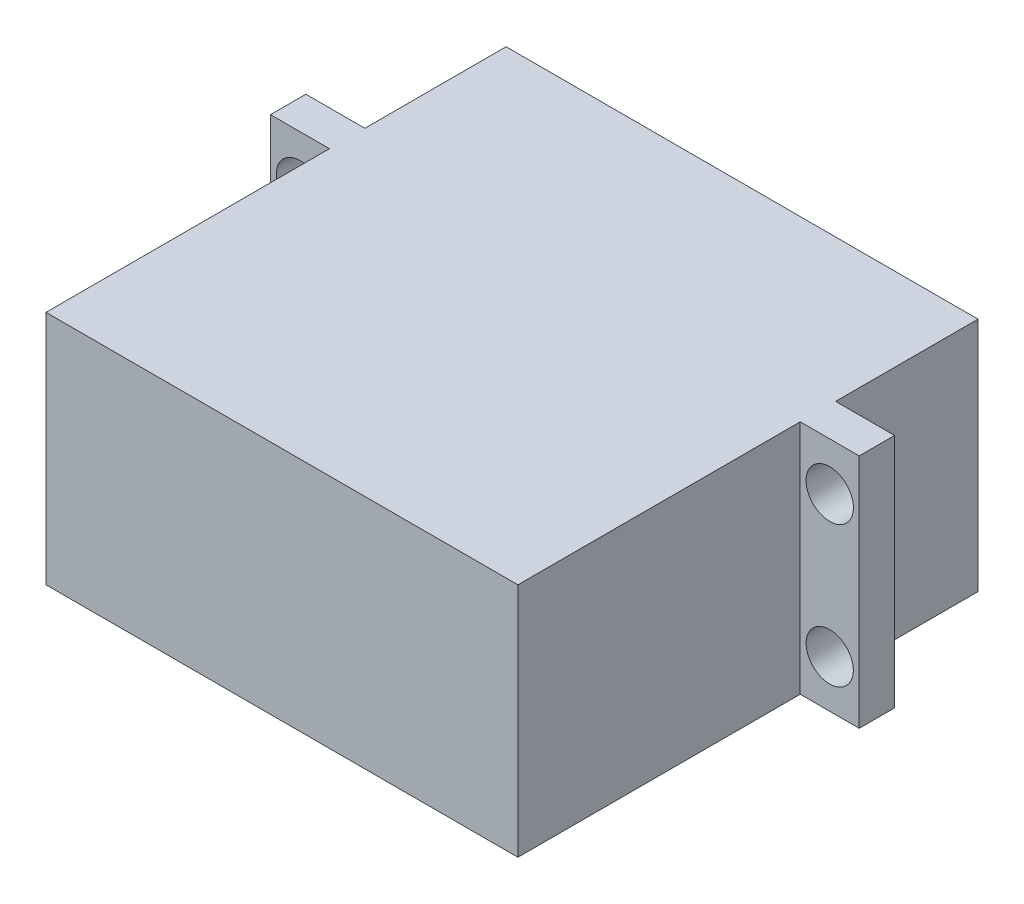
from build123d import *

# Parameters (mm, degrees)
SKETCH_3_W               = 40
SKETCH_3_H               = 20
EXTRUDE_2_DEPTH          = 39
SKETCH_4_W               = 3
SKETCH_4_H               = 20
EXTRUDE_3_DEPTH          = 5
SKETCH_7_W               = 3
SKETCH_7_H               = 20
EXTRUDE_4_DEPTH          = 5
SKETCH_9_R               = 2
CUT_EXTRUDE_1_DEPTH      = 3
SKETCH_10_R              = 2.009071102
SKETCH_10_R_2            = 2
CUT_EXTRUDE_2_DEPTH      = 3
SKETCH_11_R              = 3
EXTRUDE_6_DEPTH          = 6
SKETCH_16_R              = 6
EXTRUDE_8_DEPTH          = 1.5
SKETCH_17_R              = 7
EXTRUDE_9_DEPTH          = 1
HOLE_WIZARD_3_48_1_D     = 1.9939
HOLE_WIZARD_3_48_1_DEPTH = 3
HOLE_WIZARD_3_48_1_TIP   = 0.599027994


with BuildPart() as part:
    # 草图3 → 凸台-拉伸2 (new body)
    with BuildSketch(Plane.XY):
        with Locations((-53.793598947, 3.253632602)):
            Rectangle(SKETCH_3_W, SKETCH_3_H)
    extrude(amount=EXTRUDE_2_DEPTH)

    # 草图4 → 凸台-拉伸3 (add)
    with BuildSketch(Plane(origin=(-33.793598947, 0, 0), x_dir=(0, 0, -1), z_dir=(1, 0, 0))):
        with Locations((-13.568387962, 3.253632602)):
            Rectangle(SKETCH_4_W, SKETCH_4_H)
    extrude(amount=EXTRUDE_3_DEPTH)

    # 草图7 → 凸台-拉伸4 (add)
    with BuildSketch(Plane.ZY.offset(73.793598947)):
        with Locations((13.473660247, 3.253632602)):
            Rectangle(SKETCH_7_W, SKETCH_7_H)
    extrude(amount=EXTRUDE_4_DEPTH)

    # 草图9 → 切除-拉伸1 (cut)
    with BuildSketch(Plane(origin=(0, 0, 11.973660247), x_dir=(-1, 0, 0), z_dir=(0, 0, -1))):
        with Locations(Location((76.293598947, 9.142056697, 0), (0, 0, 90))):
            Circle(SKETCH_9_R)
        with Locations(Location((76.293598947, -3, 0), (0, 0, 90))):
            Circle(SKETCH_9_R)
    extrude(amount=-CUT_EXTRUDE_1_DEPTH, mode=Mode.SUBTRACT)

    # 草图10 → 切除-拉伸2 (cut)
    with BuildSketch(Plane(origin=(0, 0, 12.068387962), x_dir=(-1, 0, 0), z_dir=(0, 0, -1))):
        with Locations(Location((31.293598947, 9.199024835, 0), (0, 0, 90))):
            Circle(SKETCH_10_R)
        with Locations(Location((31.293598947, -2.746367398, 0), (0, 0, 90))):
            Circle(SKETCH_10_R_2)
    extrude(amount=-CUT_EXTRUDE_2_DEPTH, mode=Mode.SUBTRACT)

    # 草图11 → 凸台-拉伸6 (add)
    with BuildSketch(Plane(origin=(0, 0, 0), x_dir=(-1, 0, 0), z_dir=(0, 0, -1))):
        with Locations(Location((43.293936899, 3.253632602, 0), (0, 0, 180))):
            Circle(SKETCH_11_R)
    extrude(amount=EXTRUDE_6_DEPTH)

    # 草图16 → 凸台-拉伸8 (add)
    with BuildSketch(Plane(origin=(0, 0, 0), x_dir=(-1, 0, 0), z_dir=(0, 0, -1))):
        with Locations(Location((43.293936899, 3.253632602, 0), (0, 0, 180))):
            Circle(SKETCH_16_R)
    extrude(amount=EXTRUDE_8_DEPTH)

    # 草图17 → 凸台-拉伸9 (add)
    with BuildSketch(Plane(origin=(0, 0, 0), x_dir=(-1, 0, 0), z_dir=(0, 0, -1))):
        with Locations(Location((43.293936899, 3.253632602, 0), (0, 0, 180))):
            Circle(SKETCH_17_R)
    extrude(amount=EXTRUDE_9_DEPTH)

    # #3-48 螺纹孔的螺纹孔钻头1
    with Locations(Plane(origin=(0, 0, -6), x_dir=(-1, 0, 0), z_dir=(0, 0, -1))):
        with Locations((43.293936899, 3.253632602)):
            Hole(HOLE_WIZARD_3_48_1_D / 2, depth=HOLE_WIZARD_3_48_1_DEPTH)
            with Locations((0, 0, -(HOLE_WIZARD_3_48_1_DEPTH + HOLE_WIZARD_3_48_1_TIP / 2))):  # 118° drill point
                Cone(0, HOLE_WIZARD_3_48_1_D / 2, HOLE_WIZARD_3_48_1_TIP, mode=Mode.SUBTRACT)


solid = part.part
